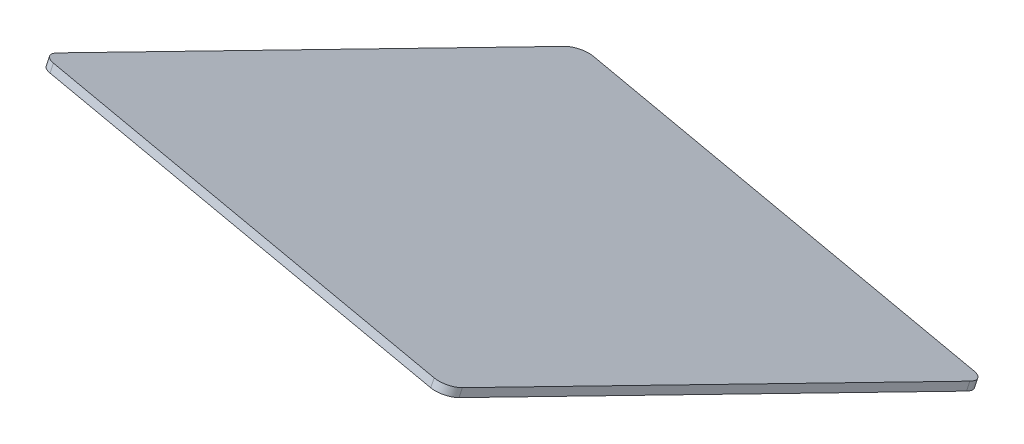
from build123d import *

# Parameters (mm, degrees)
BOSS_EXTRUDE1_DEPTH = 1.6


with BuildPart() as part:
    # Sketch1 → Boss-Extrude1 (new body)
    with BuildSketch(Plane(origin=(-12.698652334, -185.293820191, 71.509270938), x_dir=(-0.9978916860619795, 0.0638061756262259, -0.011872440369816299), z_dir=(-0.0638061756262259, -0.9310350202718788, 0.3593084510268266))):
        with BuildLine():
            Line((339.96455881, -133.506535423), (247.412538323, -149.941969817))
            ThreePointArc((247.412538323, -149.941969817), (245.477527663, -151.178016613), (244.983285575, -153.420292845))
            Line((244.983285575, -153.420292845), (261.418719968, -245.972313332))
            ThreePointArc((261.418719968, -245.972313332), (262.654766765, -247.907323992), (264.897042996, -248.40156608))
            Line((264.897042996, -248.40156608), (357.449063484, -231.966131687))
            ThreePointArc((357.449063484, -231.966131687), (359.384074144, -230.73008489), (359.878316232, -228.487808658))
            Line((359.878316232, -228.487808658), (343.442881838, -135.935788171))
            ThreePointArc((343.442881838, -135.935788171), (342.206835042, -134.000777511), (339.96455881, -133.506535423))
        make_face()
    extrude(amount=BOSS_EXTRUDE1_DEPTH)


solid = part.part
